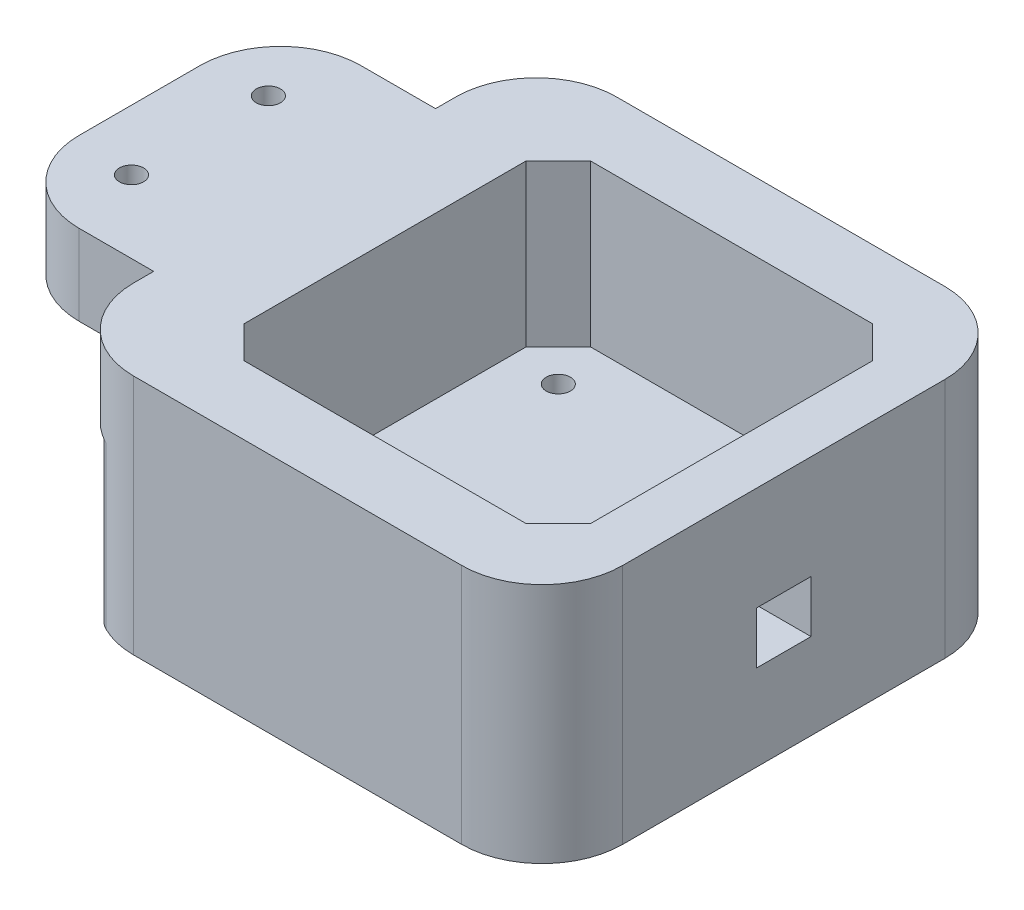
from build123d import *

# Parameters (mm, degrees)
SKETCH1_W               = 80
SKETCH1_H               = 60
BOSS_EXTRUDE1_DEPTH     = 30
FILLET1_R               = 10
SKETCH2_R               = 1.5
CUT_EXTRUDE1_DEPTH      = 59.309518948
CUT_EXTRUDE2_DEPTH      = 20
CUT_EXTRUDE3_DEPTH      = 59.309518948
CUT_EXTRUDE3_DEPTH_BACK = 59.309518948
SKETCH4_R               = 1.5
SKETCH7_W               = 19.255318266
SKETCH7_H               = 12.5
CUT_EXTRUDE5_DEPTH      = 59.309518948
FILLET2_R               = 10
CUT_EXTRUDE6_DEPTH      = 20
FILLET4_R               = 4
SKETCH9_W               = 6.759025402
SKETCH9_H               = 6.458754369
CUT_EXTRUDE7_DEPTH      = 85.866070959


with BuildPart() as part:
    # Sketch1 → Boss-Extrude1 (new body)
    with BuildSketch(Plane(origin=(0, 0, 0), x_dir=(1, 0, 0), z_dir=(0, 1, 0))):
        Rectangle(SKETCH1_W, SKETCH1_H)
    extrude(amount=BOSS_EXTRUDE1_DEPTH)

    # Fillet1
    fillet1_edges = [part.edges().sort_by_distance(p)[0] for p in [
        (40, 15, 30),
        (40, 15, -30),
    ]]
    fillet(fillet1_edges, radius=FILLET1_R)

    # Sketch2 → Cut-Extrude1 (cut, through all)
    with BuildSketch(Plane(origin=(0, 30, 0), x_dir=(1, 0, 0), z_dir=(0, 1, 0))):
        with Locations(Location((-3.5, 15.5, 0), (0, 0, 270))):
            Circle(SKETCH2_R)
        with Locations(Location((27.5, 15.5, 0), (0, 0, 270))):
            Circle(SKETCH2_R)
        with Locations(Location((-3.5, -15.5, 0), (0, 0, 270))):
            Circle(SKETCH2_R)
        with Locations(Location((27.5, -15.5, 0), (0, 0, 270))):
            Circle(SKETCH2_R)
    extrude(amount=-CUT_EXTRUDE1_DEPTH, mode=Mode.SUBTRACT)

    # Sketch3 → Cut-Extrude2 (cut)
    with BuildSketch(Plane(origin=(0, 30, 0), x_dir=(1, 0, 0), z_dir=(0, 1, 0))):
        Polygon((-9.5, 17.5), (-5.5, 21.5), (29.5, 21.5), (33.5, 17.5), (33.5, -17.5), (29.5, -21.5), (-5.5, -21.5), (-9.5, -17.5), align=None)
    extrude(amount=-CUT_EXTRUDE2_DEPTH, mode=Mode.SUBTRACT)

    # Sketch4 → Cut-Extrude3 (cut, two sides: drawn at the far end of the back side and taken through both)
    with BuildSketch(Plane(origin=(0, 30, 0), x_dir=(1, 0, 0), z_dir=(0, 1, 0)).offset(-CUT_EXTRUDE3_DEPTH_BACK)):
        with Locations(Location((-32.5, 8.5, 0), (0, 0, 270))):
            Circle(SKETCH4_R)
        with Locations(Location((-32.5, -8.5, 0), (0, 0, 270))):
            Circle(SKETCH4_R)
    extrude(amount=CUT_EXTRUDE3_DEPTH + CUT_EXTRUDE3_DEPTH_BACK, mode=Mode.SUBTRACT)

    # Sketch7 → Cut-Extrude5 (cut, through all)
    with BuildSketch(Plane(origin=(0, 30, 0), x_dir=(1, 0, 0), z_dir=(0, 1, 0))):
        with Locations((-30.372340867, 23.75)):
            Rectangle(SKETCH7_W, SKETCH7_H)
        with Locations((-30.372340867, -23.75)):
            Rectangle(SKETCH7_W, SKETCH7_H)
    extrude(amount=-CUT_EXTRUDE5_DEPTH, mode=Mode.SUBTRACT)

    # Fillet2
    fillet2_edges = [part.edges().sort_by_distance(p)[0] for p in [
        (-20.744681734, 15, 30),
        (-40, 15, 17.5),
        (-20.744681734, 15, -30),
        (-40, 15, -17.5),
    ]]
    fillet(fillet2_edges, radius=FILLET2_R)

    # Sketch8 → Cut-Extrude6 (cut)
    with BuildSketch(Plane.XZ):
        with BuildLine():
            Line((-17.426212782, 27.440238091), (-17.426212782, -27.440238091))
            ThreePointArc((-17.426212782, -27.440238091), (-19.877460897, -24.073370197), (-20.744681734, -20))
            Line((-20.744681734, -20), (-20.744681734, -17.5))
            Line((-20.744681734, -17.5), (-30, -17.5))
            ThreePointArc((-30, -17.5), (-37.071067812, -14.571067812), (-40, -7.5))
            Line((-40, -7.5), (-40, 7.5))
            ThreePointArc((-40, 7.5), (-37.071067812, 14.571067812), (-30, 17.5))
            Line((-30, 17.5), (-20.744681734, 17.5))
            Line((-20.744681734, 17.5), (-20.744681734, 20))
            ThreePointArc((-20.744681734, 20), (-19.877460897, 24.073370197), (-17.426212782, 27.440238091))
        make_face()
    extrude(amount=-CUT_EXTRUDE6_DEPTH, mode=Mode.SUBTRACT)

    # Fillet4
    fillet4_edges = [part.edges().sort_by_distance(p)[0] for p in [
        (-17.426212782, 10, 27.440238091),
        (-17.426212782, 10, -27.440238091),
    ]]
    fillet(fillet4_edges, radius=FILLET4_R)

    # Sketch9 → Cut-Extrude7 (cut, through all)
    with BuildSketch(Plane.ZY.offset(-33.5)):
        with Locations((0, 13.888622085)):
            Rectangle(SKETCH9_W, SKETCH9_H)
    extrude(amount=-CUT_EXTRUDE7_DEPTH, mode=Mode.SUBTRACT)


solid = part.part
